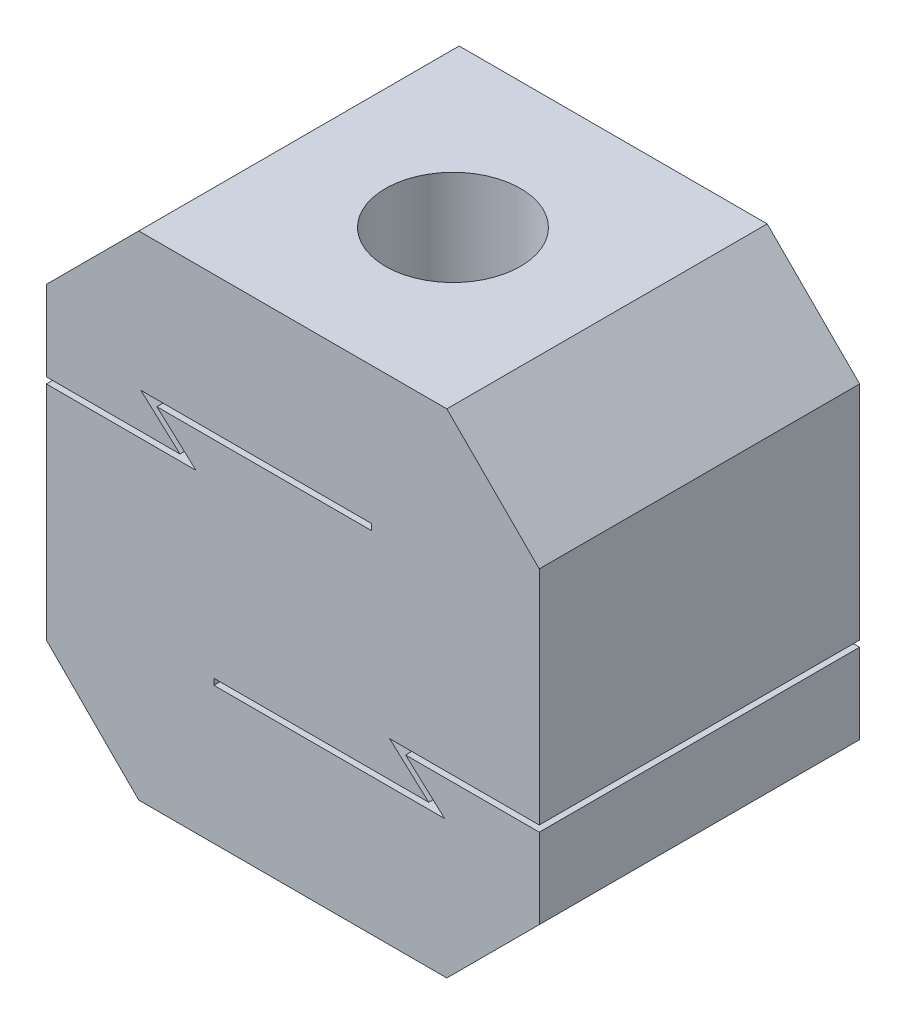
from build123d import *

# Parameters (mm, degrees)
SKETCH1_W                    = 80
SKETCH1_H                    = 80
BOSS_EXTRUDE1_DEPTH          = 52
CHAMFER1_SIZE                = 15
CUT_EXTRUDE_THIN2_DEPTH      = 77.837490849
CUT_EXTRUDE_THIN2_DEPTH_BACK = 77.837490849
SKETCH3_R                    = 10.96
CUT_EXTRUDE2_DEPTH           = 16


with BuildPart() as part:
    # Sketch1 → Boss-Extrude1 (new body)
    with BuildSketch(Plane.XY):
        Rectangle(SKETCH1_W, SKETCH1_H)
    extrude(amount=BOSS_EXTRUDE1_DEPTH)

    # Chamfer1
    chamfer1_edges = [part.edges().sort_by_distance(p)[0] for p in [
        (40, -40, 26),
        (-40, -40, 26),
        (-40, 40, 26),
        (40, 40, 26),
    ]]
    chamfer(chamfer1_edges, length=CHAMFER1_SIZE)

    # Sketch2 → Cut-Extrude-Thin2 (cut, two sides: drawn at the far end of the back side and taken through both)
    with BuildSketch(Plane(origin=(0, 0, 0), x_dir=(-1, 0, 0), z_dir=(0, 0, -1)).offset(-CUT_EXTRUDE_THIN2_DEPTH_BACK)):
        Polygon((44.0879895, 11), (15.722057871, 11), (22.061953445, 16.76959481), (-12.810565673, 16.76959481), (-12.810565673, 17.76959481), (24.646552449, 17.76959481), (18.306656875, 12), (44.0879895, 12), align=None)
        Polygon((-43.151938768, -11), (-15.722057871, -11), (-22.061953445, -16.76959481), (12.810565673, -16.76959481), (12.810565673, -17.76959481), (-24.646552449, -17.76959481), (-18.306656875, -12), (-43.151938768, -12), align=None)
    extrude(amount=CUT_EXTRUDE_THIN2_DEPTH + CUT_EXTRUDE_THIN2_DEPTH_BACK, mode=Mode.SUBTRACT)

    # Sketch3 → Cut-Extrude2 (cut)
    with BuildSketch(Plane(origin=(0, 40, 0), x_dir=(1, 0, 0), z_dir=(0, 1, 0))):
        with Locations(Location((0, -26, 0), (0, 0, 270))):
            Circle(SKETCH3_R)
    cut_extrude2 = extrude(amount=-CUT_EXTRUDE2_DEPTH, mode=Mode.SUBTRACT)

    # Mirror1: Cut-Extrude2 across plane
    add(cut_extrude2.mirror(Plane.ZX), mode=Mode.SUBTRACT)


solid = part.part
